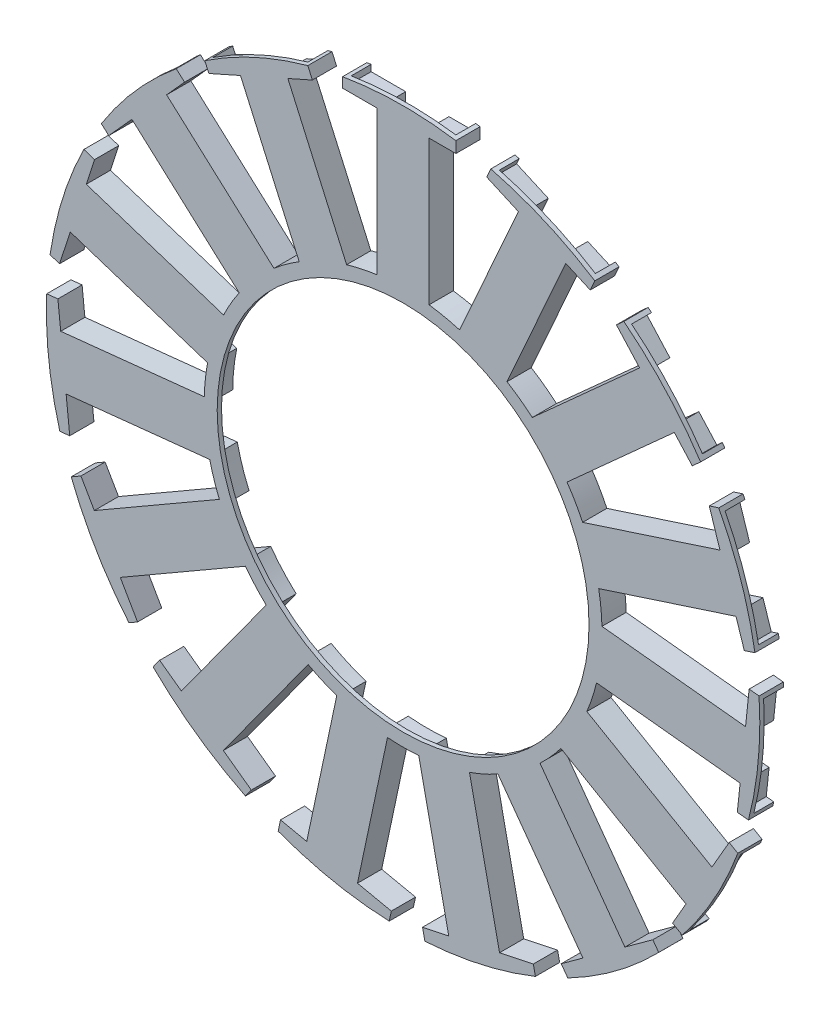
from build123d import *

# Parameters (mm, degrees)
SKETCH_1_R               = 22.5
EXTRUDE_2_DEPTH          = 2.3
PATTERN_CIRCULAR_2_COUNT = 15
SKETCH_3_R               = 3.25
CUT_EXTRUDE_2_DEPTH      = 3.2
SKETCH_5_R               = 1.6
CUT_EXTRUDE_3_DEPTH      = 10
SKETCH_6_R               = 1.6
CUT_EXTRUDE_4_DEPTH      = 10
SHELL_2_T                = 0.5
CUT_EXTRUDE_6_DEPTH      = 10
CUT_EXTRUDE_6_DEPTH_BACK = 10
SKETCH_8_R               = 21.5
CUT_EXTRUDE_7_DEPTH      = 10
CUT_EXTRUDE_7_DEPTH_BACK = 10
SKETCH_9_R               = 60.032442796
SKETCH_9_R_2             = 41.25


with BuildPart() as part:
    # ｽｹｯﾁ1 → ﾎﾞｽ - 押し出し2 (new body)
    with BuildSketch(Plane.XY):
        Circle(SKETCH_1_R)
        with BuildLine():
            Line((0, 0), (-2.5, 0))
            Line((-2.5, 0), (-2.5, 40))
            Line((-2.5, 40), (-6.5, 40))
            Line((-6.5, 40), (-6.5, 43.517237964))
            ThreePointArc((-6.5, 43.517237964), (-0.454315658, 43.997654452), (5.6, 43.64218143))
            Line((5.6, 43.64218143), (5.6, 40))
            Line((5.6, 40), (2.5, 40))
            Line((2.5, 40), (2.5, 0))
            Line((2.5, 0), (0, 0))
        make_face()
    extrude_2 = extrude(amount=EXTRUDE_2_DEPTH)

    # 円形ﾊﾟﾀｰﾝ2: ﾎﾞｽ - 押し出し2 ×15 about axis
    pattern_circular_2_axis = Axis((0, 0, 0), (0, 0, 1))
    for i in range(1, PATTERN_CIRCULAR_2_COUNT):
        add(extrude_2.rotate(pattern_circular_2_axis, i * 360 / PATTERN_CIRCULAR_2_COUNT))

    # ｽｹｯﾁ3 → ｶｯﾄ - 押し出し2 (cut)
    with BuildSketch(Plane.XY.offset(2.3)):
        Circle(SKETCH_3_R)
    extrude(amount=-CUT_EXTRUDE_2_DEPTH, mode=Mode.SUBTRACT)

    # ｽｹｯﾁ5 → ｶｯﾄ - 押し出し3 (cut)
    with BuildSketch(Plane.XY.offset(2.3)):
        with Locations((-15, 0)):
            Circle(SKETCH_5_R)
        with Locations((15, 0)):
            Circle(SKETCH_5_R)
        with Locations((10.4775, -15.75)):
            Circle(SKETCH_5_R)
        with Locations((-10.4775, -15.75)):
            Circle(SKETCH_5_R)
    extrude(amount=-CUT_EXTRUDE_3_DEPTH, mode=Mode.SUBTRACT)

    # ｽｹｯﾁ6 → ｶｯﾄ - 押し出し4 (cut)
    with BuildSketch(Plane.XY.offset(2.3)):
        with Locations((-16.6, 8)):
            Circle(SKETCH_6_R)
        with Locations((-18.1, -8)):
            Circle(SKETCH_6_R)
        with Locations((18.1, -8)):
            Circle(SKETCH_6_R)
        with Locations((16.6, 8)):
            Circle(SKETCH_6_R)
    extrude(amount=-CUT_EXTRUDE_4_DEPTH, mode=Mode.SUBTRACT)

    # ｼｪﾙ2
    shell_2_openings = [part.faces().sort_by_distance(p)[0] for p in [
        (-4.419386248, 20.79157761, 0),
    ]]
    offset(amount=SHELL_2_T, openings=shell_2_openings, kind=Kind.INTERSECTION)

    # ｽｹｯﾁ8 → ｶｯﾄ - 押し出し6 (cut, two sides: drawn at the far end of the back side and taken through both)
    with BuildSketch(Plane(origin=(0, 0, 2.3), x_dir=(-1, 0, 0), z_dir=(0, 0, -1)).offset(-CUT_EXTRUDE_6_DEPTH_BACK)):
        with Locations(Location((0, 0, 0), (0, 0, 180))):
            Circle(SKETCH_8_R)
    extrude(amount=CUT_EXTRUDE_6_DEPTH + CUT_EXTRUDE_6_DEPTH_BACK, mode=Mode.SUBTRACT)

    # ｽｹｯﾁ9 → ｶｯﾄ - 押し出し7 (cut, two sides: drawn at the far end of the back side and taken through both)
    with BuildSketch(Plane(origin=(0, 0, 2.3), x_dir=(-1, 0, 0), z_dir=(0, 0, -1)).offset(-CUT_EXTRUDE_7_DEPTH_BACK)):
        Circle(SKETCH_9_R)
        Circle(SKETCH_9_R_2, mode=Mode.SUBTRACT)
    extrude(amount=CUT_EXTRUDE_7_DEPTH + CUT_EXTRUDE_7_DEPTH_BACK, mode=Mode.SUBTRACT)


solid = part.part
